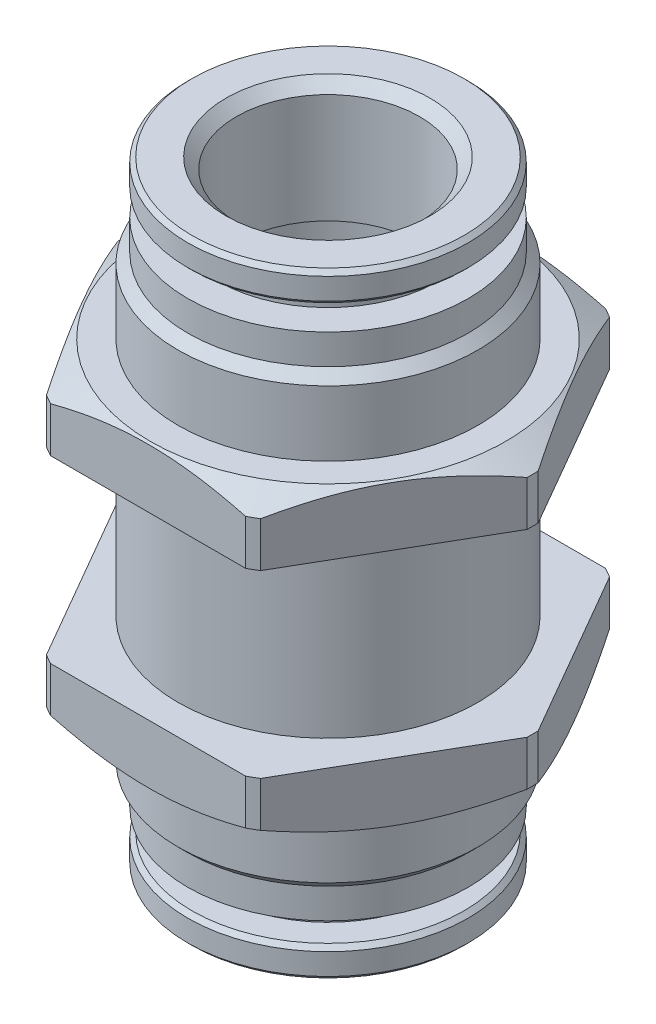
from build123d import *

# Parameters (mm, degrees)
CUT_EXTRUDE_1_DEPTH      = 29.158391289
CUT_EXTRUDE_1_DEPTH_BACK = 29.158391289
SKETCH_2_R               = 15.051532373


with BuildPart() as part:
    # 草圖1 → 旋轉1 (revolve)
    with BuildSketch(Plane.XY, mode=Mode.PRIVATE) as revolve_1_sk:
        with BuildLine():
            ThreePointArc((6.5, -9), (6.125834261, -8.741421356), (6.235424869, -8.3))
            Line((6.235424869, -8.3), (6.1, -8.3))
            Line((6.1, -8.3), (6.1, -3.4))
            Line((6.1, -3.4), (5.75, -3.4))
            Line((5.75, -3.4), (5.75, 3.4))
            Line((5.75, 3.4), (6.1, 3.4))
            Line((6.1, 3.4), (6.1, 8.3))
            Line((6.1, 8.3), (6.235424869, 8.3))
            ThreePointArc((6.235424869, 8.3), (6.125834261, 8.741421356), (6.5, 9))
            Line((6.5, 9), (7.1, 9))
            Line((7.1, 9), (7.1, 12.5))
            Line((7.1, 12.5), (6.1, 12.5))
            Line((6.1, 12.5), (6.1, 19.792893219))
            Line((6.1, 19.792893219), (6.807106781, 20.5))
            Line((6.807106781, 20.5), (9.067157288, 20.5))
            Line((9.067157288, 20.5), (9.35, 20.217157288))
            Line((9.35, 20.217157288), (9.35, 18.782842712))
            Line((9.35, 18.782842712), (9.067157288, 18.5))
            Line((9.067157288, 18.5), (7.35, 18.5))
            Line((7.35, 18.5), (7.35, 17))
            Line((7.35, 17), (9.35, 17))
            Line((9.35, 17), (9.35, 15))
            Line((9.35, 15), (10, 14.35))
            Line((10, 14.35), (10, -14.35))
            Line((10, -14.35), (9.35, -15))
            Line((9.35, -15), (9.35, -17))
            Line((9.35, -17), (7.35, -17))
            Line((7.35, -17), (7.35, -18.5))
            Line((7.35, -18.5), (9.067157288, -18.5))
            Line((9.067157288, -18.5), (9.35, -18.782842712))
            Line((9.35, -18.782842712), (9.35, -20.217157288))
            Line((9.35, -20.217157288), (9.067157288, -20.5))
            Line((9.067157288, -20.5), (6.807106781, -20.5))
            Line((6.807106781, -20.5), (6.1, -19.792893219))
            Line((6.1, -19.792893219), (6.1, -12.5))
            Line((6.1, -12.5), (7.1, -12.5))
            Line((7.1, -12.5), (7.1, -9))
            Line((7.1, -9), (6.5, -9))
        make_face()
        Polygon((11.85, 10), (10, 10), (10, 6), (13.65, 6), (13.65, 9), align=None)
        Polygon((13.65, -6), (10, -6), (10, -10), (11.85, -10), (13.65, -9), align=None)
    revolve(revolve_1_sk.sketch.rotate(Axis((0, 26.248758247, 0), (0, -1, 0)), 90), axis=Axis((0, 26.248758247, 0), (0, -1, 0)))

    # 草圖2 → 除料-伸長1 (cut, two sides: drawn at the far end of the back side and taken through both)
    with BuildSketch(Plane(origin=(0, 0, 0), x_dir=(1, 0, 0), z_dir=(0, 1, 0)).offset(-CUT_EXTRUDE_1_DEPTH_BACK)):
        Circle(SKETCH_2_R)
        Polygon((13.856406461, 0), (6.92820323, 12), (-6.92820323, 12), (-13.856406461, 0), (-6.92820323, -12), (6.92820323, -12), align=None, mode=Mode.SUBTRACT)
    extrude(amount=CUT_EXTRUDE_1_DEPTH + CUT_EXTRUDE_1_DEPTH_BACK, mode=Mode.SUBTRACT)


solid = part.part
